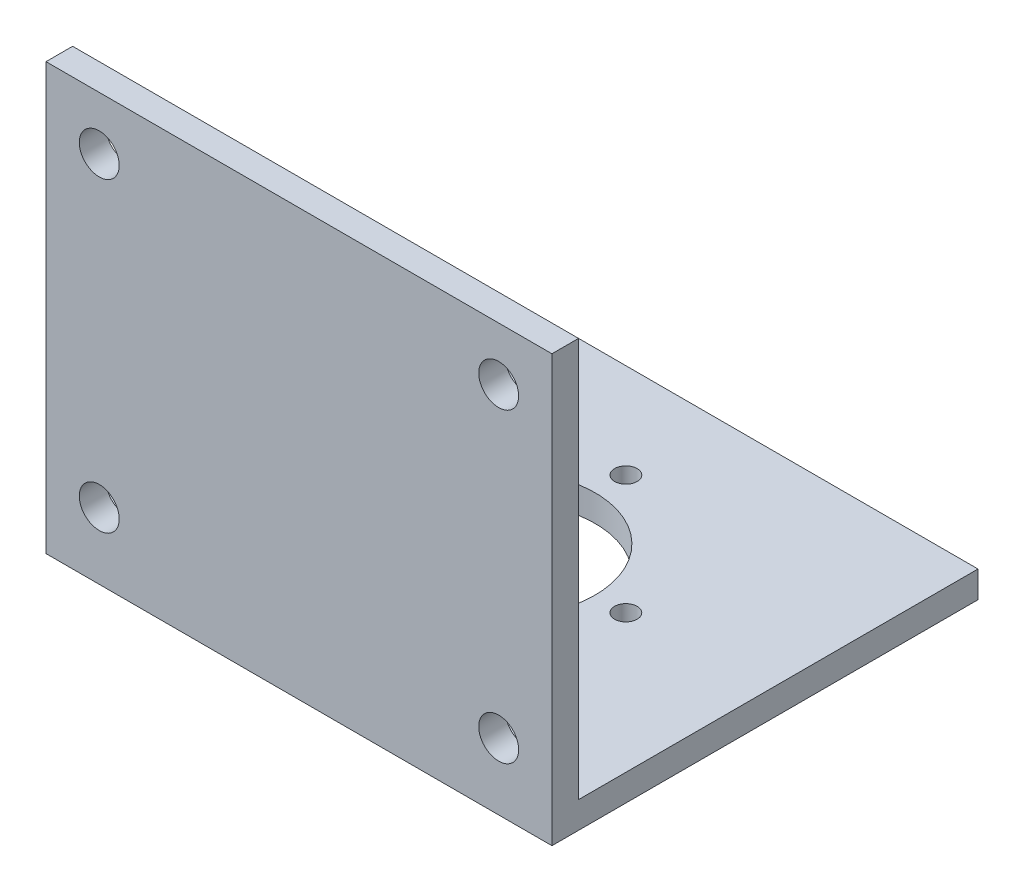
from build123d import *

# Parameters (mm, degrees)
SKETCH_3_W               = 38
SKETCH_3_H               = 32
EXTRUDE_330_DEPTH        = 2
SKETCH_4_W               = 38
SKETCH_4_H               = 32
EXTRUDE_444_DEPTH        = 2
CUT_EXTRUDE_1_DEPTH      = 59.034472514
CUT_EXTRUDE_1_DEPTH_BACK = 59.034472514
SKETCH_5_R               = 1.5
CUT_EXTRUDE_2_DEPTH      = 59.034472514
CUT_EXTRUDE_2_DEPTH_BACK = 59.034472514
SKETCH_6_R               = 6.656
SKETCH_6_R_2             = 0.8448


with BuildPart() as part:
    # 草图3 → Extrude 330 (new body)
    with BuildSketch(Plane.XY):
        with Locations((19, 16)):
            Rectangle(SKETCH_3_W, SKETCH_3_H)
    extrude(amount=EXTRUDE_330_DEPTH)

    # 草图4 → Extrude 444 (add)
    with BuildSketch(Plane(origin=(0, 0, 0), x_dir=(1, 0, 0), z_dir=(0, 1, 0))):
        with Locations((19, 14)):
            Rectangle(SKETCH_4_W, SKETCH_4_H)
    extrude(amount=EXTRUDE_444_DEPTH)

    # 草图5 → 切除-拉伸1 (cut, two sides: drawn at the far end of the back side and taken through both)
    with BuildSketch(Plane.XY.offset(-CUT_EXTRUDE_1_DEPTH_BACK)):
        with Locations((4, 5)):
            Circle(SKETCH_5_R)
        with Locations((4, 28)):
            Circle(SKETCH_5_R)
        with Locations((34, 5)):
            Circle(SKETCH_5_R)
        with Locations((34, 28)):
            Circle(SKETCH_5_R)
    extrude(amount=CUT_EXTRUDE_1_DEPTH + CUT_EXTRUDE_1_DEPTH_BACK, mode=Mode.SUBTRACT)

    # 草图6 → 切除-拉伸2 (cut, two sides: drawn at the far end of the back side and taken through both)
    with BuildSketch(Plane(origin=(0, 0, 0), x_dir=(1, 0, 0), z_dir=(0, 1, 0)).offset(-CUT_EXTRUDE_2_DEPTH_BACK)):
        with Locations(Location((18.664843729, 13.928843729, 0), (0, 0, 270))):
            Circle(SKETCH_6_R)
        with Locations(Location((9.704843729, 13.928843729, 0), (0, 0, 270))):
            Circle(SKETCH_6_R_2)
        with Locations(Location((18.664843729, 22.888843729, 0), (0, 0, 270))):
            Circle(SKETCH_6_R_2)
        with Locations(Location((27.624843729, 13.928843729, 0), (0, 0, 270))):
            Circle(SKETCH_6_R_2)
        with Locations(Location((18.664843729, 4.968843729, 0), (0, 0, 270))):
            Circle(SKETCH_6_R_2)
    extrude(amount=CUT_EXTRUDE_2_DEPTH + CUT_EXTRUDE_2_DEPTH_BACK, mode=Mode.SUBTRACT)


solid = part.part
